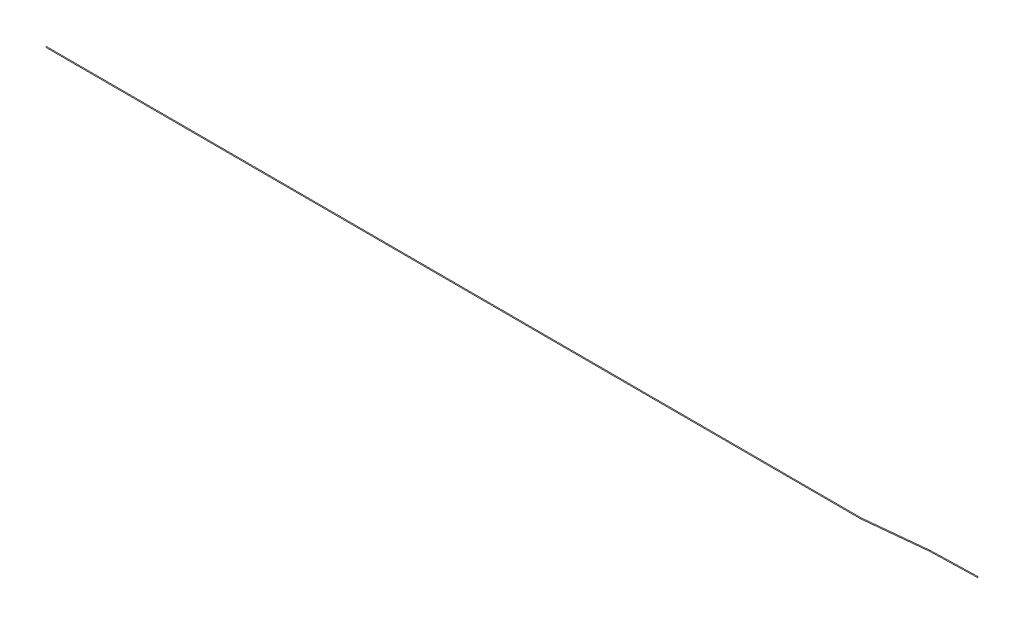
from build123d import *

# Parameters (mm, degrees)
SWEEP1_PROFILE_R = 0.325


with BuildPart() as part:
    # Sweep1: sweep along a curve in space
    with BuildLine() as sweep1_path:
        Line((-275.601885049, 9.61449752, -32.279861456), (386.995296262, 7.852598976, -33.30800324))
        Line((437.512442978, 7.587225517, -38.73927274), (386.995296262, 7.852598976, -33.30800324))
        Line((437.512442978, 7.587225517, -38.73927274), (476.296907949, 8.314321447, -39.039173796))
    # Sweep1 profile (on start of the path) → Sweep1 (sweep)
    with BuildSketch(Plane(origin=(-275.601885049, 9.61449752, -32.279861456), x_dir=(0.00265907004239425, 0.9999964646670055, 0), z_dir=(0.9999952608195356, -0.00265906684126819, -0.0015516771580601555))):
        Circle(SWEEP1_PROFILE_R)
    sweep(path=sweep1_path.line, transition=Transition.RIGHT)


solid = part.part
